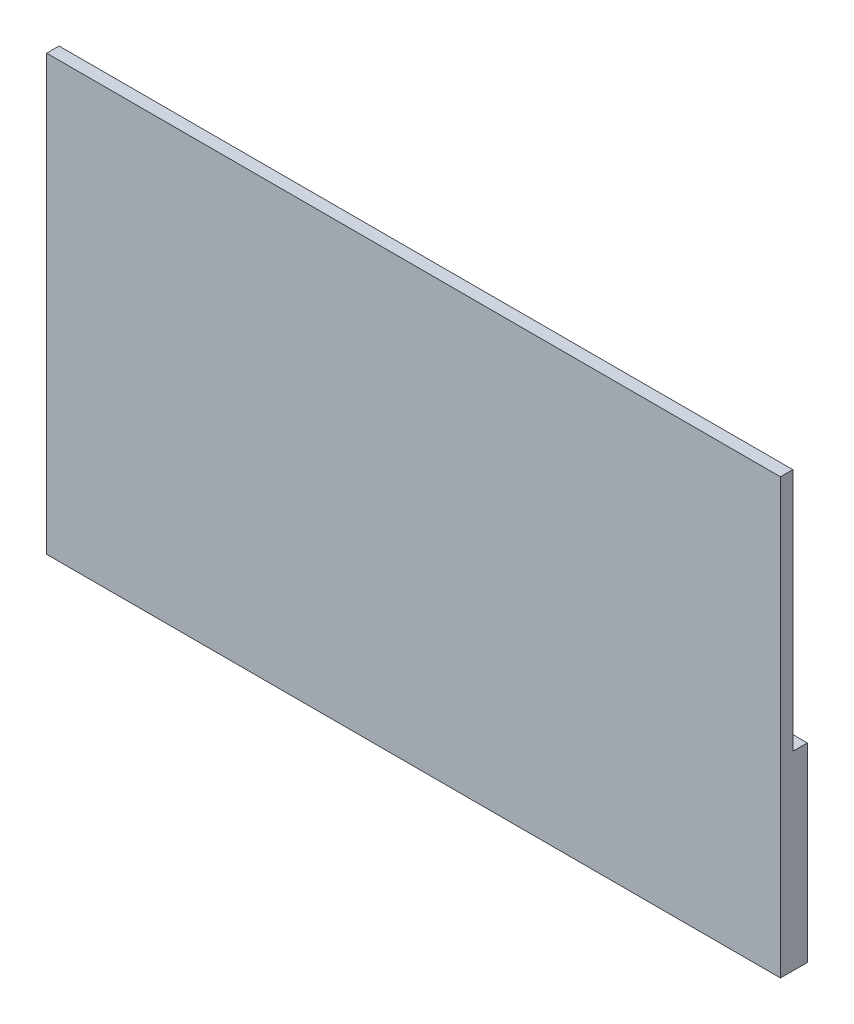
from build123d import *

# Parameters (mm, degrees)
SKETCH1_W                   = 355
SKETCH1_H                   = 210
BOSS_EXTRUDE1_DEPTH         = 6
SKETCH2_W                   = 355
SKETCH2_H                   = 92
BOSS_EXTRUDE2_DEPTH         = 7
M4_TAPPED_HOLE2_D           = 3.3
M4_TAPPED_HOLE2_DEPTH       = 2.008579979
M4_TAPPED_HOLE2_CSINK_D     = 4.05
M4_TAPPED_HOLE2_CSINK_ANGLE = 90
M4_TAPPED_HOLE2_TIP         = 0.991420021


with BuildPart() as part:
    # Sketch1 → Boss-Extrude1 (new body)
    with BuildSketch(Plane.XY):
        Rectangle(SKETCH1_W, SKETCH1_H)
    extrude(amount=BOSS_EXTRUDE1_DEPTH)

    # Sketch2 → Boss-Extrude2 (add)
    with BuildSketch(Plane.XY):
        with Locations((0, -59)):
            Rectangle(SKETCH2_W, SKETCH2_H)
    extrude(amount=-BOSS_EXTRUDE2_DEPTH)

    # M4 Tapped Hole2
    with Locations(Plane(origin=(0, 0, -7), x_dir=(-1, 0, 0), z_dir=(0, 0, -1))):
        with Locations((37.5, -29), (-37.5, -29)):
            CounterSinkHole(M4_TAPPED_HOLE2_D / 2, M4_TAPPED_HOLE2_CSINK_D / 2, depth=M4_TAPPED_HOLE2_DEPTH, counter_sink_angle=M4_TAPPED_HOLE2_CSINK_ANGLE)
            with Locations((0, 0, -(M4_TAPPED_HOLE2_DEPTH + M4_TAPPED_HOLE2_TIP / 2))):  # 118° drill point
                Cone(0, M4_TAPPED_HOLE2_D / 2, M4_TAPPED_HOLE2_TIP, mode=Mode.SUBTRACT)


solid = part.part
